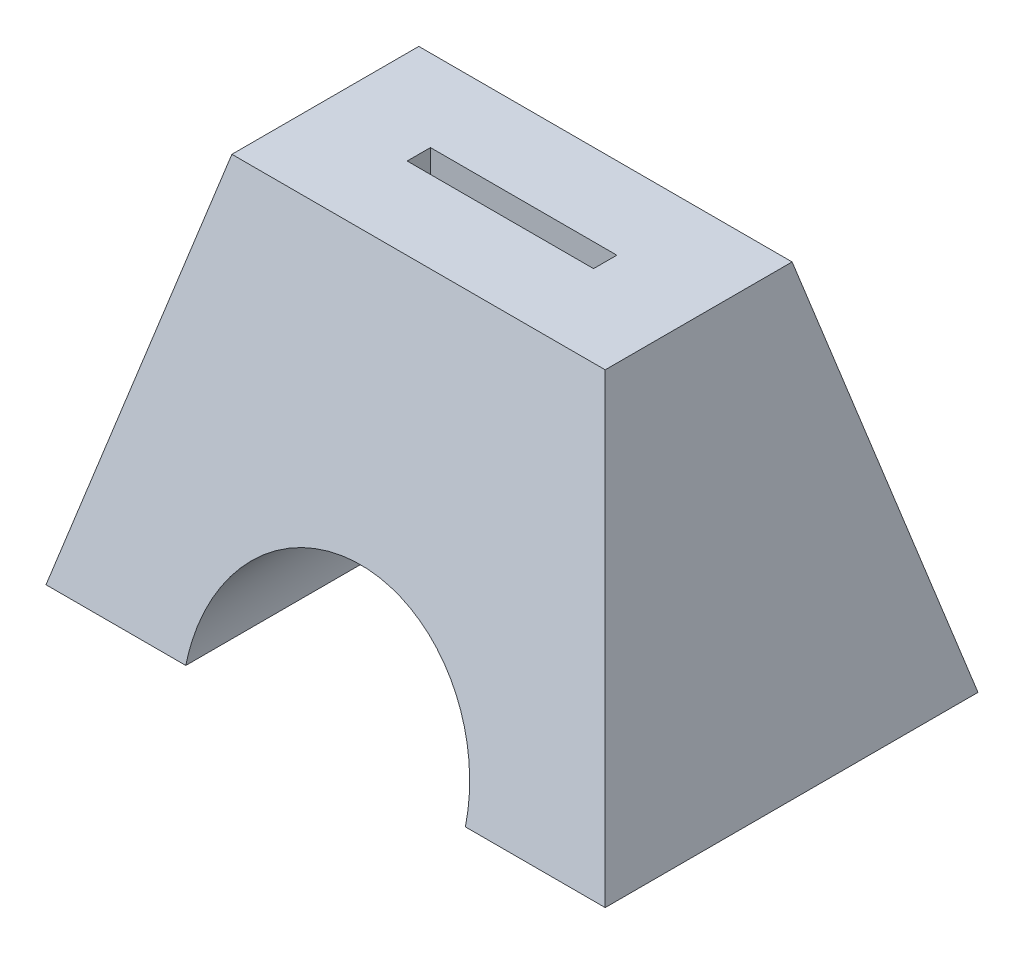
from build123d import *

# Parameters (mm, degrees)
SKETCH_11_W              = 120
SKETCH_11_H              = 80
EXTRUDE_3_DEPTH          = 80
EXTRUDE_3_TAPER          = 14
CUT_EXTRUDE_START        = 80
SKETCH_12_W              = 40
SKETCH_12_H              = 5
CUT_EXTRUDE_1_DEPTH      = 20
CUT_EXTRUDE_2_DEPTH      = 108.70329631
CUT_EXTRUDE_2_DEPTH_BACK = 108.70329631
SKETCH_13_R              = 30


with BuildPart() as part:
    # 스케치11 → 보스-돌출3 (new body)
    with BuildSketch(Plane(origin=(0, 0, 0), x_dir=(1, 0, 0), z_dir=(0, 1, 0))):
        Rectangle(SKETCH_11_W, SKETCH_11_H)
    extrude(amount=EXTRUDE_3_DEPTH, taper=EXTRUDE_3_TAPER)

    # 스케치12 → 컷-돌출1 (cut)
    with BuildSketch(Plane(origin=(0, 0, 0), x_dir=(1, 0, 0), z_dir=(0, 1, 0)).offset(CUT_EXTRUDE_START)):
        Rectangle(SKETCH_12_W, SKETCH_12_H)
    extrude(amount=-CUT_EXTRUDE_1_DEPTH, mode=Mode.SUBTRACT)

    # 스케치13 → 컷-돌출2 (cut, two sides: drawn at the far end of the back side and taken through both)
    with BuildSketch(Plane.XY.offset(-CUT_EXTRUDE_2_DEPTH_BACK)):
        Circle(SKETCH_13_R)
    extrude(amount=CUT_EXTRUDE_2_DEPTH + CUT_EXTRUDE_2_DEPTH_BACK, mode=Mode.SUBTRACT)


solid = part.part
